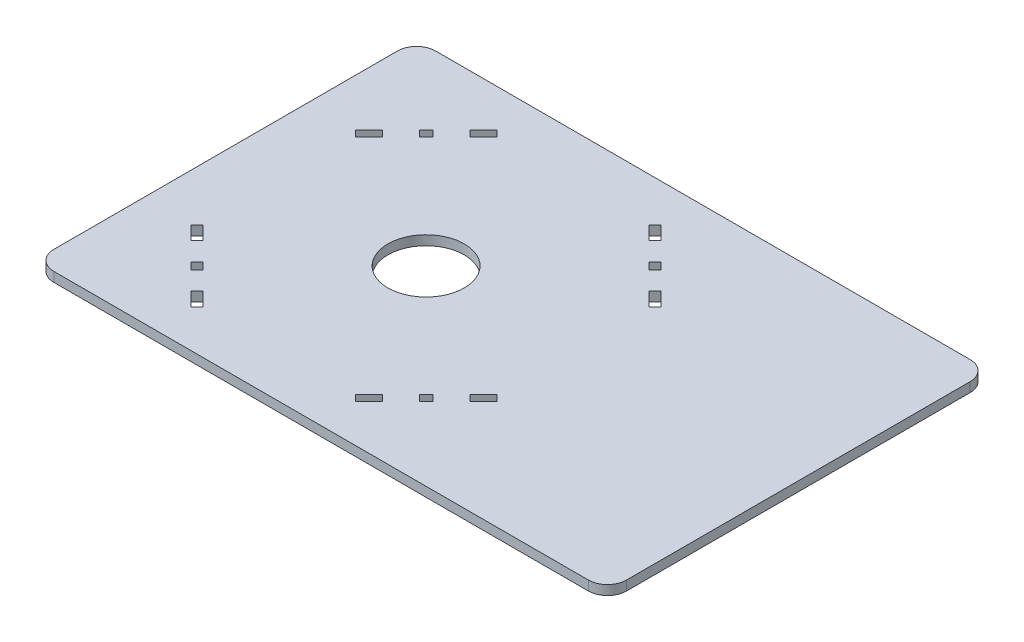
from build123d import *

# Parameters (mm, degrees)
SKETCH1_W           = 300
SKETCH1_H           = 200
SKETCH1_R           = 20
BOSS_EXTRUDE2_DEPTH = 5
FILLET1_R           = 10


with BuildPart() as part:
    # Sketch1 → Boss-Extrude2 (new body)
    with BuildSketch(Plane(origin=(0, 0, 0), x_dir=(1, 0, 0), z_dir=(0, 1, 0))):
        Rectangle(SKETCH1_W, SKETCH1_H)
        with Locations(Location((-45, 0, 0), (0, 0, 270))):
            Circle(SKETCH1_R, mode=Mode.SUBTRACT)
        Polygon((-88.055456352, 80.126524164), (-95.126524164, 73.055456352), (-91.944543648, 69.873475836), (-84.873475836, 76.944543648), align=None, mode=Mode.SUBTRACT)
        Polygon((-121.944543648, 39.873475836), (-114.873475836, 46.944543648), (-118.055456352, 50.126524164), (-125.126524164, 43.055456352), align=None, mode=Mode.SUBTRACT)
        Polygon((-1.944543648, 80.126524164), (5.126524164, 73.055456352), (1.944543648, 69.873475836), (-5.126524164, 76.944543648), align=None, mode=Mode.SUBTRACT)
        Polygon((35.126524164, 43.055456352), (28.055456352, 50.126524164), (24.873475836, 46.944543648), (31.944543648, 39.873475836), align=None, mode=Mode.SUBTRACT)
        Polygon((-1.944543648, -80.126524164), (5.126524164, -73.055456352), (1.944543648, -69.873475836), (-5.126524164, -76.944543648), align=None, mode=Mode.SUBTRACT)
        Polygon((35.126524164, -43.055456352), (28.055456352, -50.126524164), (24.873475836, -46.944543648), (31.944543648, -39.873475836), align=None, mode=Mode.SUBTRACT)
        Polygon((-125.126524164, -43.055456352), (-118.055456352, -50.126524164), (-114.873475836, -46.944543648), (-121.944543648, -39.873475836), align=None, mode=Mode.SUBTRACT)
        Polygon((-88.055456352, -80.126524164), (-95.126524164, -73.055456352), (-91.944543648, -69.873475836), (-84.873475836, -76.944543648), align=None, mode=Mode.SUBTRACT)
        Polygon((15.176776695, 56.641242789), (11.641242789, 60.176776695), (14.823223305, 63.358757211), (18.358757211, 59.823223305), align=None, mode=Mode.SUBTRACT)
        Polygon((15.176776695, -56.641242789), (11.641242789, -60.176776695), (14.823223305, -63.358757211), (18.358757211, -59.823223305), align=None, mode=Mode.SUBTRACT)
        Polygon((-101.641242789, -60.176776695), (-105.176776695, -56.641242789), (-108.358757211, -59.823223305), (-104.823223305, -63.358757211), align=None, mode=Mode.SUBTRACT)
        Polygon((-105.176776695, 56.641242789), (-101.641242789, 60.176776695), (-104.823223305, 63.358757211), (-108.358757211, 59.823223305), align=None, mode=Mode.SUBTRACT)
    extrude(amount=BOSS_EXTRUDE2_DEPTH)

    # Fillet1
    fillet1_edges = [part.edges().sort_by_distance(p)[0] for p in [
        (-150, 2.5, -100),
        (150, 2.5, -100),
        (150, 2.5, 100),
        (-150, 2.5, 100),
    ]]
    fillet(fillet1_edges, radius=FILLET1_R)


solid = part.part
